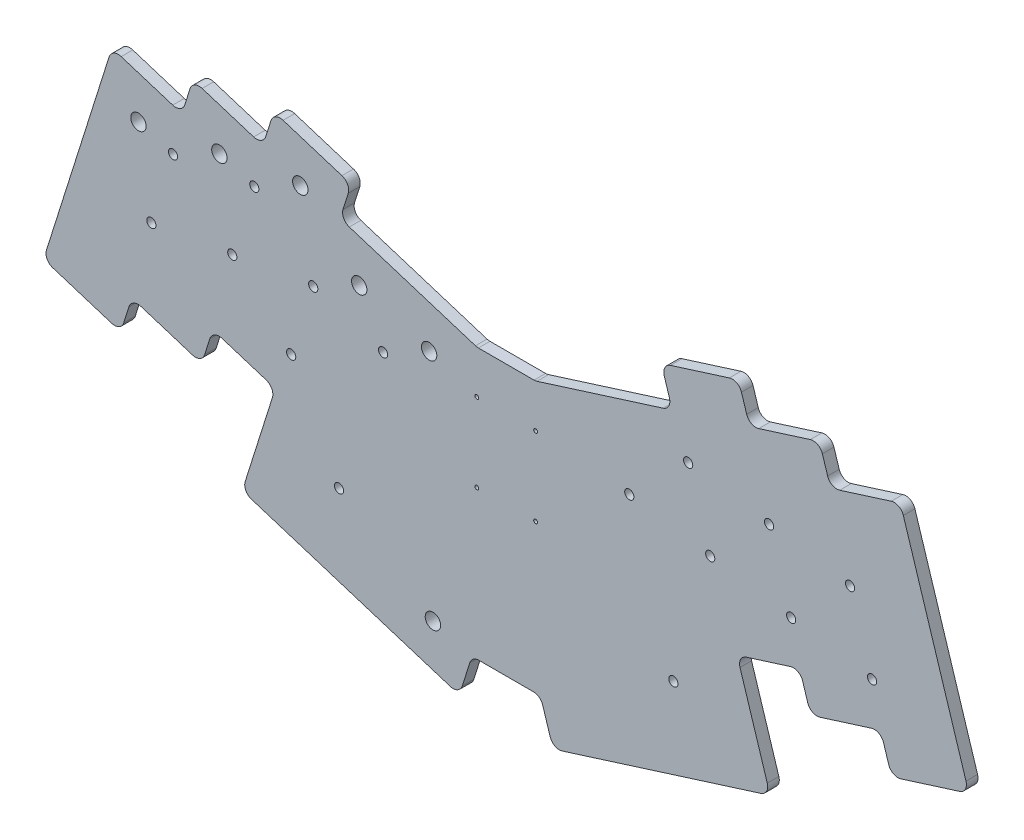
from build123d import *

# Parameters (mm, degrees)
SKETCH1_R           = 1.190623
SKETCH1_R_2         = 1.190627
SKETCH1_R_3         = 1.190626
SKETCH1_R_4         = 1.190625
SKETCH1_R_5         = 1.190624
SKETCH1_R_6         = 1.190628
SKETCH1_R_7         = 1.9939
SKETCH1_R_8         = 0.5
BOSS_EXTRUDE1_DEPTH = 3


with BuildPart() as part:
    # Sketch1 → Boss-Extrude1 (new body)
    with BuildSketch(Plane.XY):
        with BuildLine():
            Line((104.968827, -55.794314), (103.615653, -60.086042))
            ThreePointArc((103.615653, -60.086042), (102.385728566, -61.551801144), (100.479593, -61.718568))
            Line((100.479593, -61.718568), (87.127552, -57.508685))
            ThreePointArc((87.127552, -57.508685), (85.221400275, -57.675416583), (83.9915, -59.141213))
            Line((83.9915, -59.141213), (82.638323, -63.432941))
            ThreePointArc((82.638323, -63.432941), (81.408394852, -64.898690118), (79.502266, -65.065473))
            Line((79.502266, -65.065473), (66.150224, -60.855587))
            ThreePointArc((66.150224, -60.855587), (64.244088242, -61.02234775), (63.014174, -62.488115))
            Line((63.014174, -62.488115), (46.776059, -113.988833))
            ThreePointArc((46.776059, -113.988833), (46.942822186, -115.894968516), (48.408585, -117.124888))
            Line((48.408585, -117.124888), (63.668055, -121.936181))
            ThreePointArc((63.668055, -121.936181), (65.574204538, -121.769435597), (66.804115, -120.303649))
            Line((66.804115, -120.303649), (68.157287, -116.011926))
            ThreePointArc((68.157287, -116.011926), (69.387211331, -114.546165389), (71.293348, -114.379399))
            Line((71.293348, -114.379399), (84.645384, -118.589282))
            ThreePointArc((84.645384, -118.589282), (86.551538999, -118.422552795), (87.78144, -116.956753))
            Line((87.78144, -116.956753), (89.134615, -112.665026))
            ThreePointArc((89.134615, -112.665026), (90.364542844, -111.19927904), (92.27067, -111.032498))
            Line((92.27067, -111.032498), (103.715276, -114.640965))
            ThreePointArc((103.715276, -114.640965), (105.181030723, -115.870890231), (105.347808, -117.777022))
            Line((105.347808, -117.777022), (98.281218, -140.189373))
            ThreePointArc((98.281218, -140.189373), (98.447984756, -142.095508452), (99.913747, -143.325429))
            Line((99.913747, -143.325429), (151.414462, -159.563543))
            ThreePointArc((151.414462, -159.563543), (153.320596182, -159.396771864), (154.550517, -157.931011))
            Line((154.550517, -157.931011), (156.499763, -151.748809))
            ThreePointArc((156.499763, -151.748809), (157.405773888, -150.484456349), (158.88405, -150.000573))
            Line((158.88405, -150.000573), (173.000221, -150.000576))
            ThreePointArc((173.000221, -150.000576), (174.478488224, -150.484472097), (175.384512, -151.74881))
            Line((175.384512, -151.74881), (177.333756, -157.931011))
            ThreePointArc((177.333756, -157.931011), (178.563666363, -159.396793874), (180.469813, -159.563539))
            Line((180.469813, -159.563539), (231.970529, -143.32543))
            ThreePointArc((231.970529, -143.32543), (233.436289923, -142.095506386), (233.603057, -140.18937))
            Line((233.603057, -140.18937), (226.536464, -117.777022))
            ThreePointArc((226.536464, -117.777022), (226.703215942, -115.870876032), (228.168999, -114.640966))
            Line((228.168999, -114.640966), (239.613602, -111.032497))
            ThreePointArc((239.613602, -111.032497), (241.519721203, -111.199292709), (242.749655, -112.665026))
            Line((242.749655, -112.665026), (244.102833, -116.956749))
            ThreePointArc((244.102833, -116.956749), (245.33275051, -118.422517183), (247.238889, -118.589279))
            Line((247.238889, -118.589279), (260.590925, -114.379399))
            ThreePointArc((260.590925, -114.379399), (262.497073777, -114.546144678), (263.726987, -116.011928))
            Line((263.726987, -116.011928), (265.080159, -120.303654))
            ThreePointArc((265.080159, -120.303654), (266.310073195, -121.769434184), (268.21622, -121.936182))
            Line((268.21622, -121.936182), (283.47569, -117.124888))
            ThreePointArc((283.47569, -117.124888), (284.94147585, -115.894978684), (285.108216, -113.98883))
            Line((285.108216, -113.98883), (268.870102, -62.488115))
            ThreePointArc((268.870102, -62.488115), (267.640181911, -61.022352077), (265.734046, -60.855588))
            Line((265.734046, -60.855588), (252.382012, -65.065468))
            ThreePointArc((252.382012, -65.065468), (250.475863383, -64.898725926), (249.245954, -63.43294))
            Line((249.245954, -63.43294), (247.892776, -59.141216))
            ThreePointArc((247.892776, -59.141216), (246.662867771, -57.67543136), (244.756721, -57.508688))
            Line((244.756721, -57.508688), (231.40468, -61.718568))
            ThreePointArc((231.40468, -61.718568), (229.498544633, -61.551806932), (228.268627, -60.086043))
            Line((228.268627, -60.086043), (226.915449, -55.794313))
            ThreePointArc((226.915449, -55.794313), (225.685509928, -54.328581771), (223.779389, -54.161785))
            Line((223.779389, -54.161785), (208.519923, -58.973078))
            ThreePointArc((208.519923, -58.973078), (207.054132, -60.202983526), (206.887395, -62.109134))
            Line((206.887395, -62.109134), (208.240572, -66.400862))
            ThreePointArc((208.240572, -66.400862), (208.073804347, -68.306999096), (206.608041, -69.536921))
            Line((206.608041, -69.536921), (173.90813, -79.84716))
            ThreePointArc((173.90813, -79.84716), (173.536675423, -79.933776781), (173.156367, -79.962871))
            Line((173.156367, -79.962871), (158.727909, -79.962872))
            ThreePointArc((158.727909, -79.962872), (158.347599344, -79.933772207), (157.976142, -79.84716))
            Line((157.976142, -79.84716), (125.276233, -69.536916))
            ThreePointArc((125.276233, -69.536916), (123.81048285, -68.30698987), (123.643706, -66.400861))
            Line((123.643706, -66.400861), (124.996881, -62.109136))
            ThreePointArc((124.996881, -62.109136), (124.830112452, -60.203001632), (123.364354, -58.973078))
            Line((123.364354, -58.973078), (108.104881, -54.161784))
            ThreePointArc((108.104881, -54.161784), (106.198732394, -54.328524877), (104.968827, -55.794314))
        make_face()
        with Locations((260.771527, -103.312897)):
            Circle(SKETCH1_R, mode=Mode.SUBTRACT)
        with Locations((255.058117, -85.19229)):
            Circle(SKETCH1_R_2, mode=Mode.SUBTRACT)
        with Locations((239.794198, -99.965999)):
            Circle(SKETCH1_R_3, mode=Mode.SUBTRACT)
        with Locations((234.080792, -81.845377)):
            Circle(SKETCH1_R_4, mode=Mode.SUBTRACT)
        with Locations((218.816871, -96.619099)):
            Circle(SKETCH1_R_5, mode=Mode.SUBTRACT)
        with Locations((213.103463, -78.498475)):
            Circle(SKETCH1_R_4, mode=Mode.SUBTRACT)
        with Locations((197.839541, -93.272199)):
            Circle(SKETCH1_R_6, mode=Mode.SUBTRACT)
        with Locations((209.266366, -129.513445)):
            Circle(SKETCH1_R_5, mode=Mode.SUBTRACT)
        with Locations((122.617905, -129.51344)):
            Circle(SKETCH1_R_2, mode=Mode.SUBTRACT)
        with Locations((134.044729, -93.272199)):
            Circle(SKETCH1_R_4, mode=Mode.SUBTRACT)
        with Locations((110.210695, -105.679413)):
            Circle(SKETCH1_R_3, mode=Mode.SUBTRACT)
        with Locations((115.924107, -87.558799)):
            Circle(SKETCH1_R_4, mode=Mode.SUBTRACT)
        with Locations((100.660188, -72.785066)):
            Circle(SKETCH1_R_4, mode=Mode.SUBTRACT)
        with Locations((94.946783, -90.905689)):
            Circle(SKETCH1_R_4, mode=Mode.SUBTRACT)
        with Locations((73.969454, -94.252592)):
            Circle(SKETCH1_R_4, mode=Mode.SUBTRACT)
        with Locations((79.584014, -76.043701)):
            Circle(SKETCH1_R_2, mode=Mode.SUBTRACT)
        with Locations((146.942133, -147.143868)):
            Circle(SKETCH1_R_7, mode=Mode.SUBTRACT)
        with Locations((145.961745, -87.068589)):
            Circle(SKETCH1_R_7, mode=Mode.SUBTRACT)
        with Locations((127.841123, -81.355183)):
            Circle(SKETCH1_R_7, mode=Mode.SUBTRACT)
        with Locations((112.577207, -66.581459)):
            Circle(SKETCH1_R_7, mode=Mode.SUBTRACT)
        with Locations((91.599877, -69.928361)):
            Circle(SKETCH1_R_7, mode=Mode.SUBTRACT)
        with Locations((70.622553, -73.275262)):
            Circle(SKETCH1_R_7, mode=Mode.SUBTRACT)
        with Locations((158.322139, -111.478591)):
            Circle(SKETCH1_R_8, mode=Mode.SUBTRACT)
        with Locations((173.562139, -111.478591)):
            Circle(SKETCH1_R_8, mode=Mode.SUBTRACT)
        with Locations((173.562139, -91.158591)):
            Circle(SKETCH1_R_8, mode=Mode.SUBTRACT)
        with Locations((158.322139, -91.158591)):
            Circle(SKETCH1_R_8, mode=Mode.SUBTRACT)
    extrude(amount=BOSS_EXTRUDE1_DEPTH)


solid = part.part
